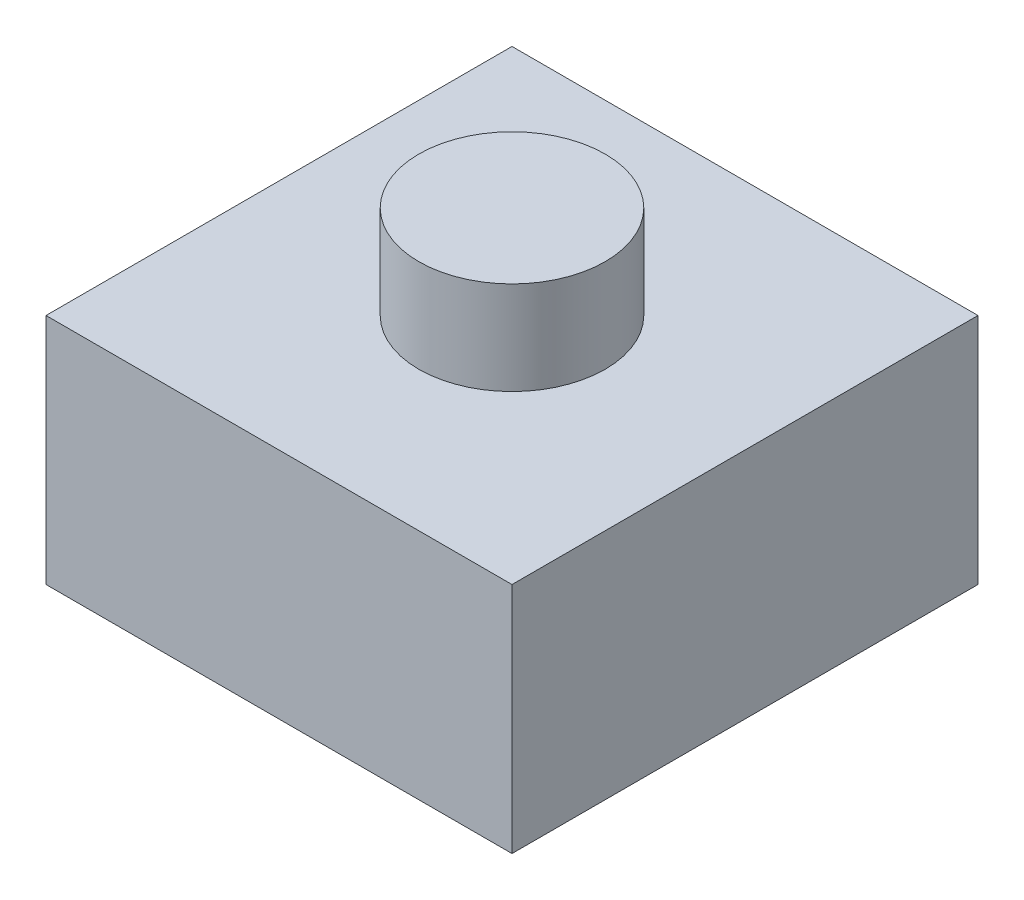
from build123d import *

# Parameters (mm, degrees)
SKETCH1_W           = 5
SKETCH1_H           = 5
BOSS_EXTRUDE1_DEPTH = 2.5
SKETCH2_R           = 1
BOSS_EXTRUDE2_DEPTH = 1


with BuildPart() as part:
    # Sketch1 → Boss-Extrude1 (new body)
    with BuildSketch(Plane(origin=(0, 0, 0), x_dir=(1, 0, 0), z_dir=(0, 1, 0))):
        Rectangle(SKETCH1_W, SKETCH1_H)
    extrude(amount=BOSS_EXTRUDE1_DEPTH)

    # Sketch2 → Boss-Extrude2 (add)
    with BuildSketch(Plane(origin=(0, 2.5, 0), x_dir=(1, 0, 0), z_dir=(0, 1, 0))):
        with Locations(Location((0, 0, 0), (0, 0, 270))):
            Circle(SKETCH2_R)
    extrude(amount=BOSS_EXTRUDE2_DEPTH)


solid = part.part
